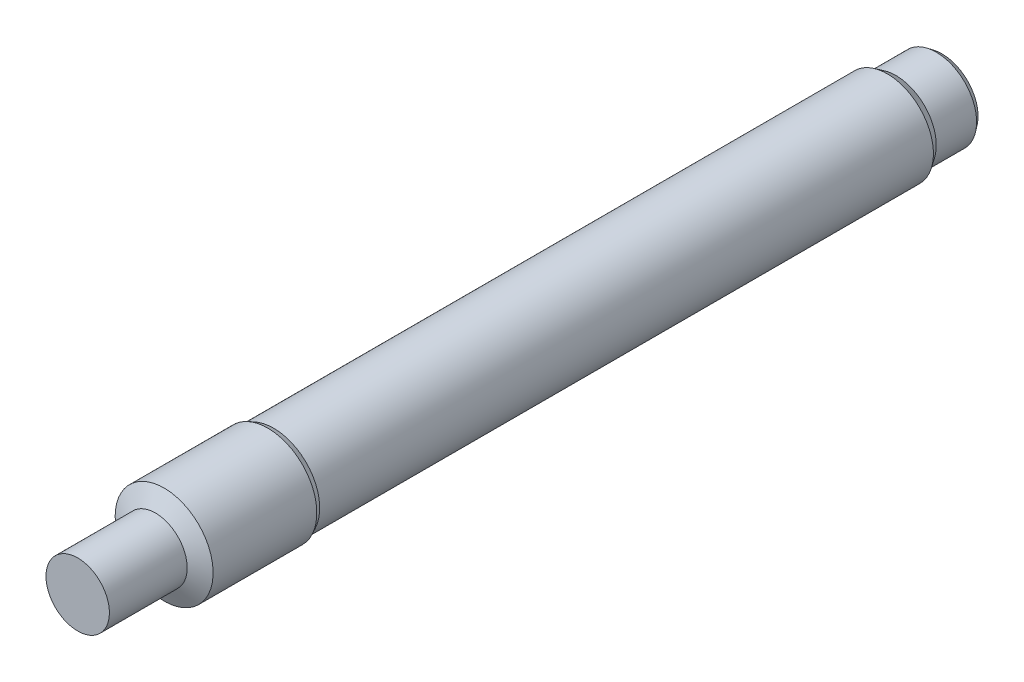
from build123d import *


with BuildPart() as part:
    # Revolve profile 1 → Revolve 1 (revolve)
    with BuildSketch(Plane(origin=(0, 0, 0), x_dir=(1, 0, 0), z_dir=(0, 1, 0)), mode=Mode.PRIVATE) as revolve_1_sk:
        Polygon((0, -300), (0, 0), (12.5, 0), (14, -2), (14, -16), (16, -19), (16, -232), (17, -234), (17, -270), (11, -273), (11, -300), align=None)
    revolve(revolve_1_sk.sketch.rotate(Axis((0, 0, -5), (0, 0, 1)), 180), axis=Axis((0, 0, -5), (0, 0, 1)))


solid = part.part
